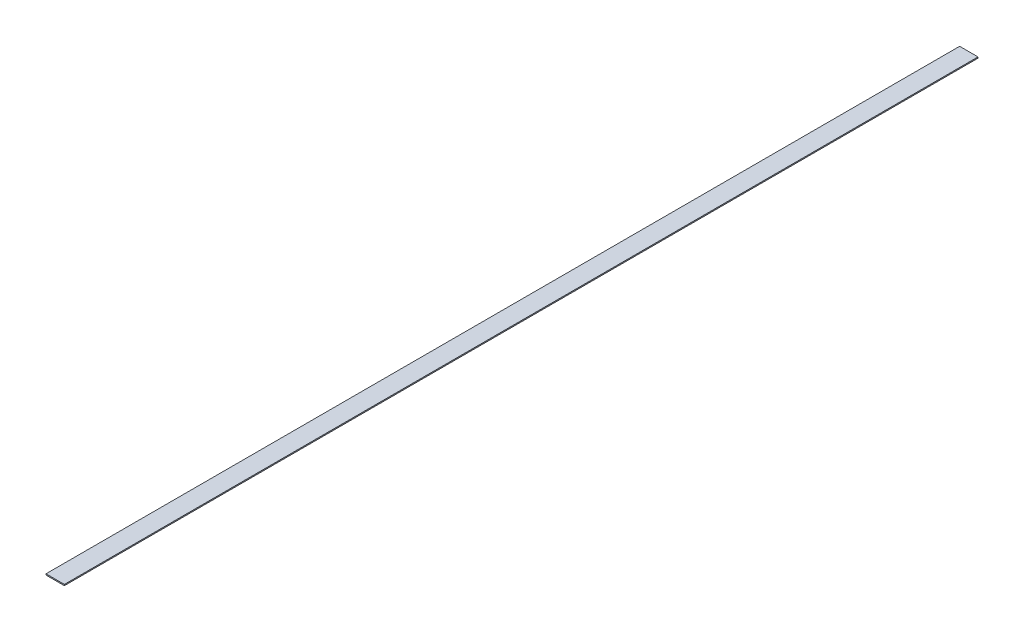
from build123d import *

# Parameters (mm, degrees)
SKETCH1_W           = 50.8
SKETCH1_H           = 2526.03
BOSS_EXTRUDE1_DEPTH = 3.175


with BuildPart() as part:
    # Sketch1 → Boss-Extrude1 (new body)
    with BuildSketch(Plane(origin=(0, 0, 0), x_dir=(1, 0, 0), z_dir=(0, 1, 0))):
        with Locations((25.4, 1263.015)):
            Rectangle(SKETCH1_W, SKETCH1_H)
    extrude(amount=BOSS_EXTRUDE1_DEPTH)


solid = part.part
